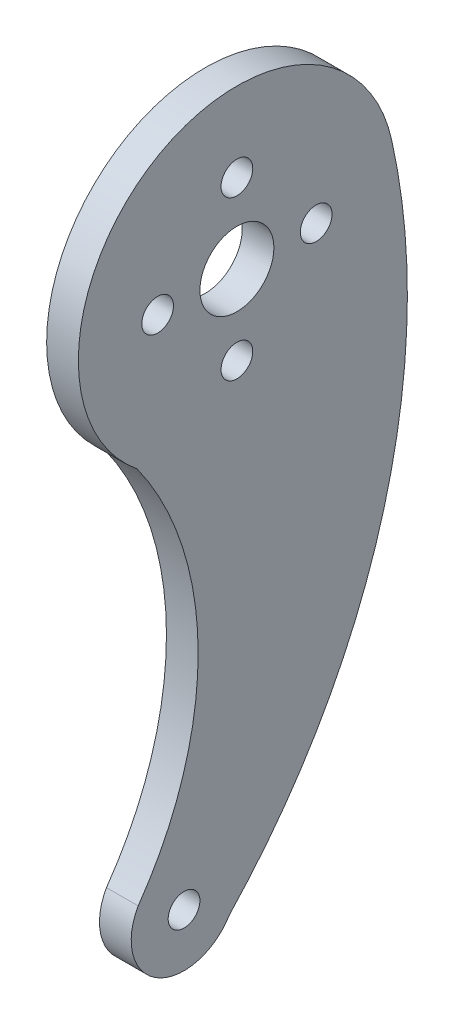
from build123d import *

# Parameters (mm, degrees)
CROQUIS1_R              = 3.5
CROQUIS1_R_2            = 1.5
SALIENTE_EXTRUIR1_DEPTH = 3


with BuildPart() as part:
    # Croquis1 → Saliente-Extruir1 (new body)
    with BuildSketch(Plane(origin=(0, 0, 0), x_dir=(0, 0, -1), z_dir=(1, 0, 0))):
        with BuildLine():
            ThreePointArc((14.657670874, 3.186327753), (-7.861609872, 12.774783372), (-9.449564448, -11.64928031))
            ThreePointArc((-9.449564448, -11.64928031), (-3.666028079, -29.56400504), (-9.338328875, -47.514260157))
            ThreePointArc((-9.338328875, -47.514260157), (-7.527733898, -54.313995983), (-0.71074339, -52.569489781))
            ThreePointArc((-0.71074339, -52.569489781), (13.908083657, -26.603024812), (14.657670874, 3.186327753))
        make_face()
        Circle(CROQUIS1_R, mode=Mode.SUBTRACT)
        with Locations((-5, -50)):
            Circle(CROQUIS1_R_2, mode=Mode.SUBTRACT)
        with Locations((-7.5, 0)):
            Circle(CROQUIS1_R_2, mode=Mode.SUBTRACT)
        with Locations((0, 7.5)):
            Circle(CROQUIS1_R_2, mode=Mode.SUBTRACT)
        with Locations((7.5, 0)):
            Circle(CROQUIS1_R_2, mode=Mode.SUBTRACT)
        with Locations((0, -7.5)):
            Circle(CROQUIS1_R_2, mode=Mode.SUBTRACT)
    extrude(amount=SALIENTE_EXTRUIR1_DEPTH)


solid = part.part
